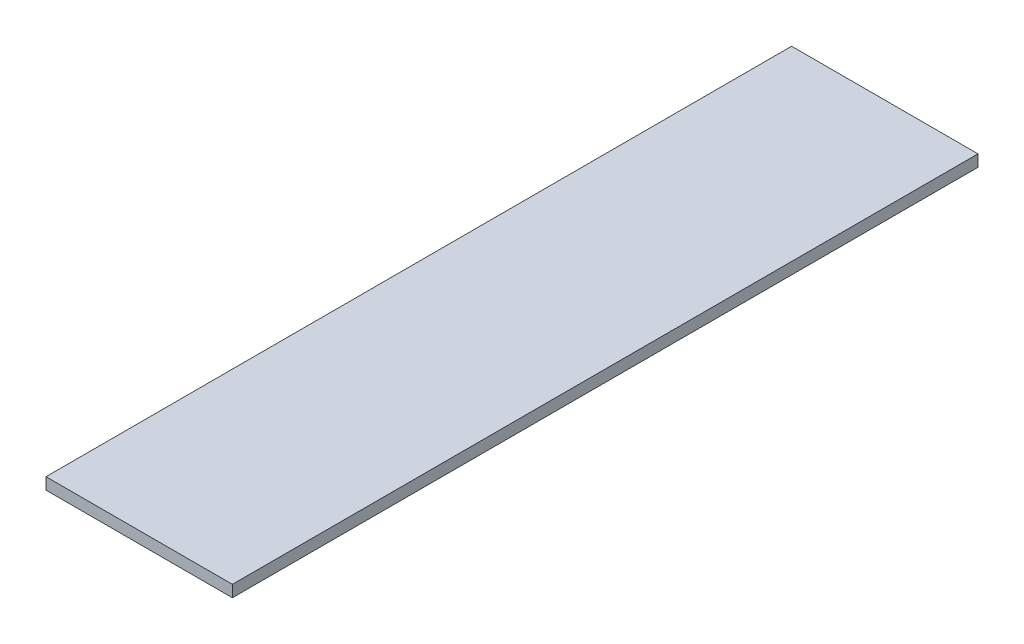
from build123d import *

# Parameters (mm, degrees)
SKETCH1_W           = 25.4
SKETCH1_H           = 101.6
BOSS_EXTRUDE1_DEPTH = 1.5875


with BuildPart() as part:
    # Sketch1 → Boss-Extrude1 (new body)
    with BuildSketch(Plane(origin=(0, 0, 0), x_dir=(1, 0, 0), z_dir=(0, 1, 0))):
        Rectangle(SKETCH1_W, SKETCH1_H)
    extrude(amount=BOSS_EXTRUDE1_DEPTH)


solid = part.part
